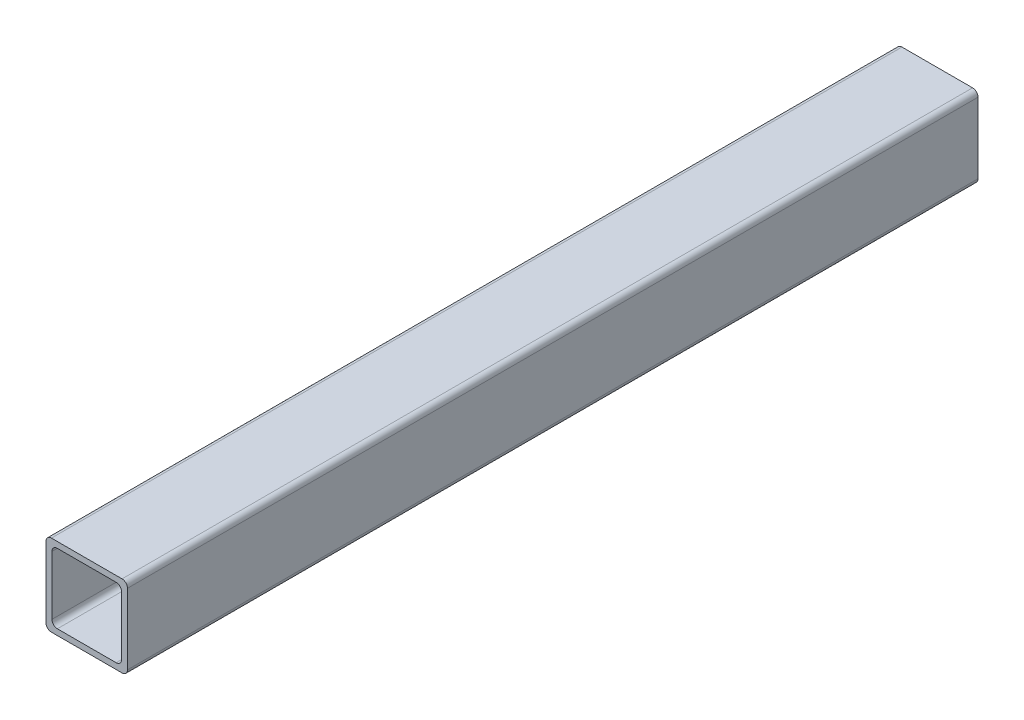
from build123d import *

# Parameters (mm, degrees)
BOSS_EXTRUDE1_DEPTH = 397
BOSS_EXTRUDE2_START = 0.678713738
BOSS_EXTRUDE2_DEPTH = 0.678713738


with BuildPart() as part:
    # Sketch1 → Boss-Extrude1 (new body)
    with BuildSketch(Plane.XY):
        with BuildLine():
            Line((2.54, 0), (35.56, 0))
            ThreePointArc((35.56, 0), (37.356051224, -0.743948776), (38.1, -2.54))
            Line((38.1, -2.54), (38.1, -35.56))
            ThreePointArc((38.1, -35.56), (37.356051224, -37.356051224), (35.56, -38.1))
            Line((35.56, -38.1), (2.54, -38.1))
            ThreePointArc((2.54, -38.1), (0.743948776, -37.356051224), (0, -35.56))
            Line((0, -35.56), (0, -2.54))
            ThreePointArc((0, -2.54), (0.743948776, -0.743948776), (2.54, 0))
        make_face()
        with BuildLine():
            Line((5.3086, -2.7686), (32.7914, -2.7686))
            ThreePointArc((32.7914, -2.7686), (34.587451224, -3.512548776), (35.3314, -5.3086))
            Line((35.3314, -5.3086), (35.3314, -32.7914))
            ThreePointArc((35.3314, -32.7914), (34.587451224, -34.587451224), (32.7914, -35.3314))
            Line((32.7914, -35.3314), (5.3086, -35.3314))
            ThreePointArc((5.3086, -35.3314), (3.512548776, -34.587451224), (2.7686, -32.7914))
            Line((2.7686, -32.7914), (2.7686, -5.3086))
            ThreePointArc((2.7686, -5.3086), (3.512548776, -3.512548776), (5.3086, -2.7686))
        make_face(mode=Mode.SUBTRACT)
    extrude(amount=BOSS_EXTRUDE1_DEPTH)

    # Sketch2 → Boss-Extrude2 (add)
    with BuildSketch(Plane(origin=(0, 0, 0), x_dir=(-1, 0, 0), z_dir=(0, 0, -1)).offset(BOSS_EXTRUDE2_START)):
        with BuildLine():
            Line((0, -35.56), (0, -2.54))
            ThreePointArc((0, -2.54), (-0.743948776, -0.743948776), (-2.54, 0))
            Line((-2.54, 0), (-35.56, 0))
            ThreePointArc((-35.56, 0), (-37.356051224, -0.743948776), (-38.1, -2.54))
            Line((-38.1, -2.54), (-38.1, -35.56))
            ThreePointArc((-38.1, -35.56), (-37.356051224, -37.356051224), (-35.56, -38.1))
            Line((-35.56, -38.1), (-2.54, -38.1))
            ThreePointArc((-2.54, -38.1), (-0.743948776, -37.356051224), (0, -35.56))
        make_face()
    extrude(amount=-BOSS_EXTRUDE2_DEPTH)


solid = part.part
